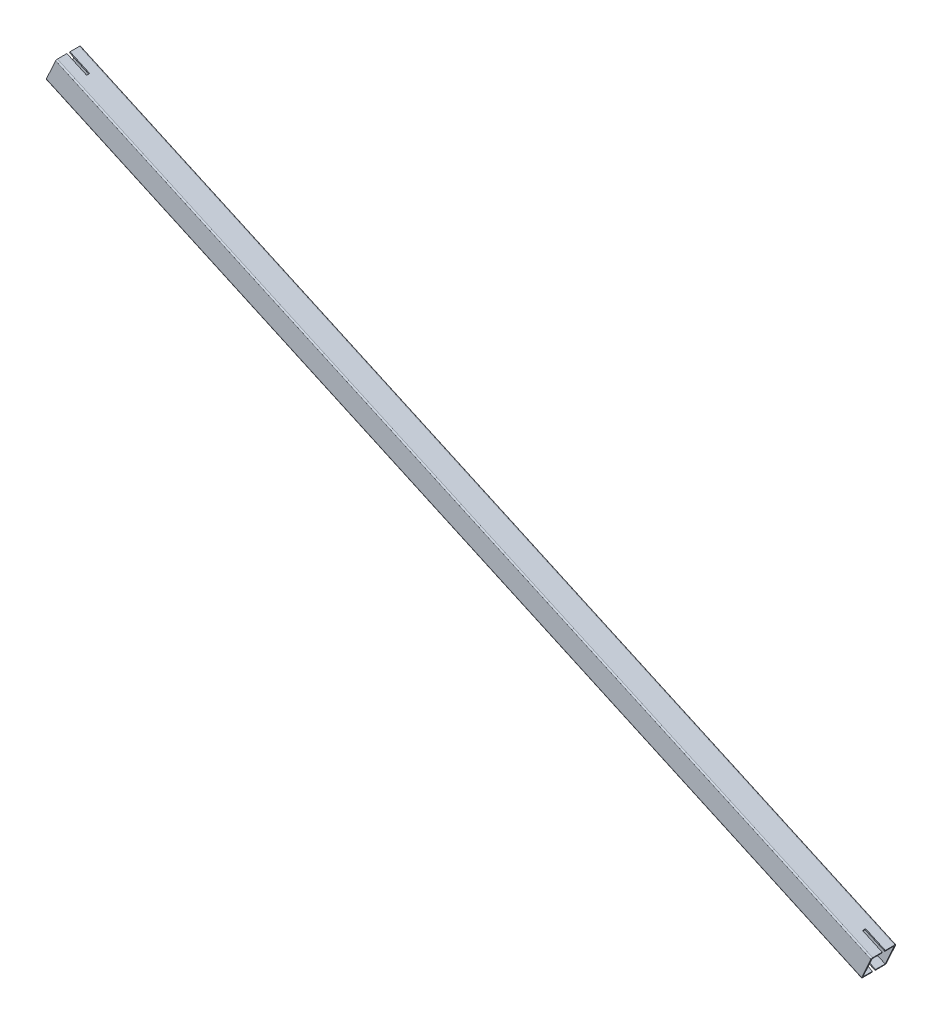
from build123d import *

# Parameters (mm, degrees)
F_8639_82_80_X_80_X_4_0_1_DEPTH = 2900
SKETCH_3_W                      = 70
SKETCH_3_H                      = 10
CUT_EXTRUDE_1_DEPTH             = 2931.442016311


with BuildPart() as part:
    # Sketch11 → Квадратная труба гост 8639-82 _80 X 80 X 4.0(1) (new body)
    with BuildSketch(Plane(origin=(0, 0, 0), x_dir=(0.4138029443011841, 0.9103664774626047, 0), z_dir=(0.9103664774626047, -0.4138029443011841, 0))):
        with BuildLine():
            Line((-35.999, -40), (35.999, -40))
            ThreePointArc((35.999, -40), (38.828134232, -38.828134232), (40, -35.999))
            Line((40, -35.999), (40, 35.999))
            ThreePointArc((40, 35.999), (38.828134232, 38.828134232), (35.999, 40))
            Line((35.999, 40), (-35.999, 40))
            ThreePointArc((-35.999, 40), (-38.828134232, 38.828134232), (-40, 35.999))
            Line((-40, 35.999), (-40, -35.999))
            ThreePointArc((-40, -35.999), (-38.828134232, -38.828134232), (-35.999, -40))
        make_face()
        with BuildLine():
            Line((-35.999, -36), (35.999, -36))
            ThreePointArc((35.999, -36), (35.999707107, -35.999707107), (36, -35.999))
            Line((36, -35.999), (36, 35.999))
            ThreePointArc((36, 35.999), (35.999707107, 35.999707107), (35.999, 36))
            Line((35.999, 36), (-35.999, 36))
            ThreePointArc((-35.999, 36), (-35.999707107, 35.999707107), (-36, 35.999))
            Line((-36, 35.999), (-36, -35.999))
            ThreePointArc((-36, -35.999), (-35.999707107, -35.999707107), (-35.999, -36))
        make_face(mode=Mode.SUBTRACT)
    extrude(amount=F_8639_82_80_X_80_X_4_0_1_DEPTH)

    # Эскиз3 → Вырез-Вытянуть1 (cut, through all)
    with BuildSketch(Plane(origin=(-16.552117772, -36.414659099, 0), x_dir=(0.9103664774626047, -0.413802944301184, 0), z_dir=(-0.41380294430118403, -0.9103664774626048, 0))):
        with Locations((35, 0)):
            Rectangle(SKETCH_3_W, SKETCH_3_H)
        with Locations((2865, 0)):
            Rectangle(SKETCH_3_W, SKETCH_3_H)
    extrude(amount=-CUT_EXTRUDE_1_DEPTH, mode=Mode.SUBTRACT)


solid = part.part
